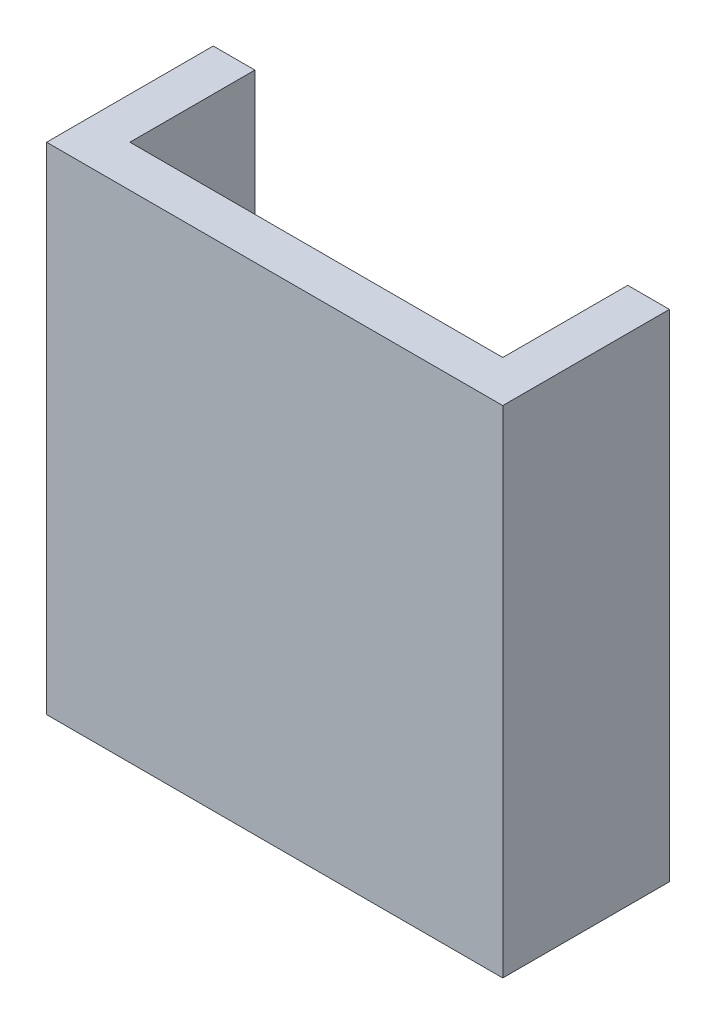
from build123d import *

# Parameters (mm, degrees)
SKETCH_2_W          = 10.95
SKETCH_2_H          = 11.9
EXTRUDE_2_DEPTH     = 4
SKETCH_1_W          = 8.95
SKETCH_1_H          = 10.9
CUT_EXTRUDE_1_DEPTH = 3


with BuildPart() as part:
    # 草圖2 → 填料-伸長2 (new body)
    with BuildSketch(Plane.XY):
        with Locations((0, -0.5)):
            Rectangle(SKETCH_2_W, SKETCH_2_H)
    extrude(amount=EXTRUDE_2_DEPTH)

    # 草圖1 → 除料-伸長1 (cut)
    with BuildSketch(Plane.XY):
        Rectangle(SKETCH_1_W, SKETCH_1_H)
    extrude(amount=CUT_EXTRUDE_1_DEPTH, mode=Mode.SUBTRACT)


solid = part.part
